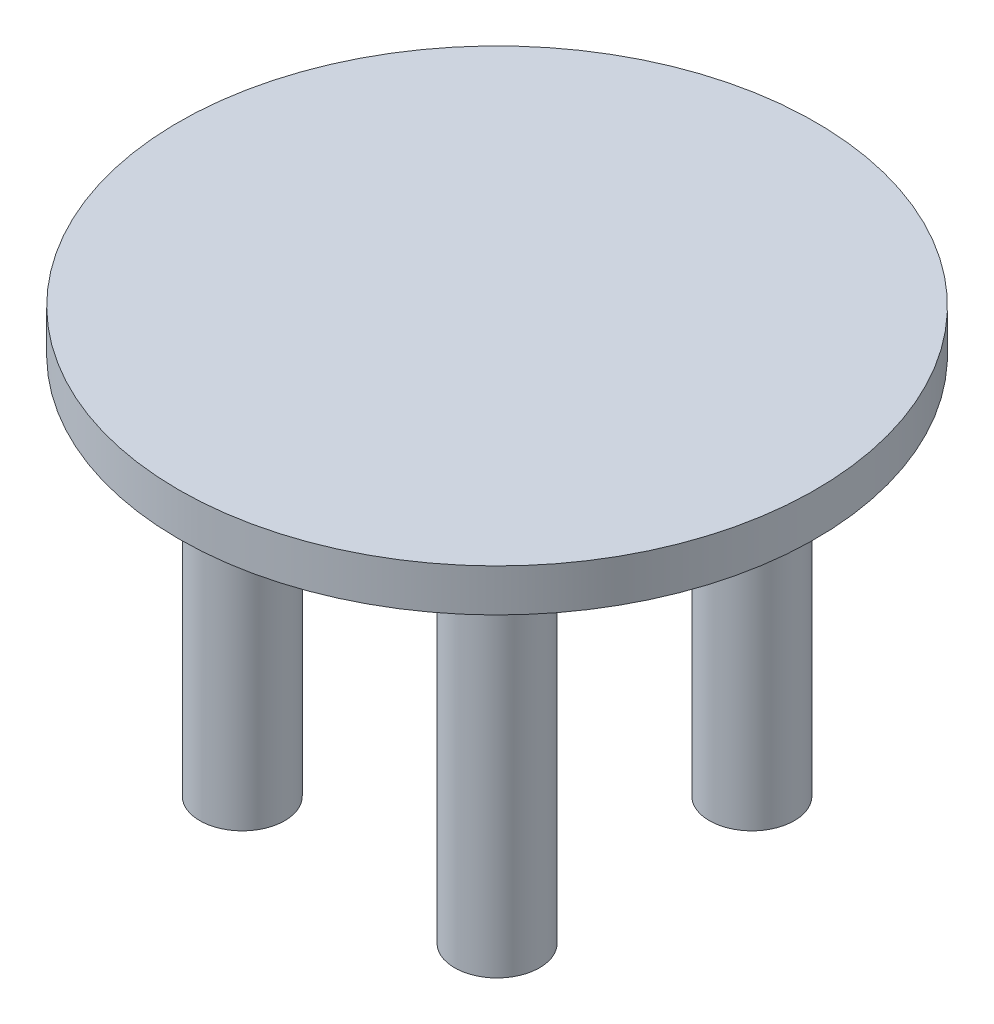
from build123d import *

# Parameters (mm, degrees)
SKETCH1_R             = 10
BOSS_EXTRUDE1_DEPTH   = 100
BOSS_EXTRUDE1_2_DEPTH = 100
SKETCH2_R             = 75
BOSS_EXTRUDE2_DEPTH   = 10


with BuildPart() as part:
    # Sketch1 → Boss-Extrude1 (new body)
    with BuildSketch(Plane(origin=(0, 0, 0), x_dir=(1, 0, 0), z_dir=(0, 1, 0))):
        with Locations(Location((30, 30, 0), (0, 0, 270))):
            Circle(SKETCH1_R)
    extrude(amount=BOSS_EXTRUDE1_DEPTH)


with BuildPart() as body_2:
    # Sketch1 → Boss-Extrude1 2 (new body)
    with BuildSketch(Plane(origin=(0, 0, 0), x_dir=(1, 0, 0), z_dir=(0, 1, 0))):
        with Locations(Location((30, -30, 0), (0, 0, 90))):
            Circle(SKETCH1_R)
    extrude(amount=BOSS_EXTRUDE1_2_DEPTH)


with BuildPart() as body_3:
    # Mirror1: mirrored copy
    add(body_2.part.mirror(Plane(origin=(0, 0, 0), x_dir=(0, 0, 1), z_dir=(1, 0, 0))))


with BuildPart() as body_4:
    # Mirror1 2: mirrored copy
    add(part.part.mirror(Plane(origin=(0, 0, 0), x_dir=(0, 0, 1), z_dir=(1, 0, 0))))


with BuildPart() as part_1:
    add(part.part)

    add(body_2.part)  # Boss-Extrude2 merges body 2

    add(body_3.part)  # Boss-Extrude2 merges body 3

    add(body_4.part)  # Boss-Extrude2 merges body 4
    # Sketch2 → Boss-Extrude2 (add)
    with BuildSketch(Plane(origin=(0, 100, 0), x_dir=(1, 0, 0), z_dir=(0, 1, 0))):
        with Locations(Location((0, 0, 0), (0, 0, 270))):
            Circle(SKETCH2_R)
    extrude(amount=-BOSS_EXTRUDE2_DEPTH)


solid = part_1.part
